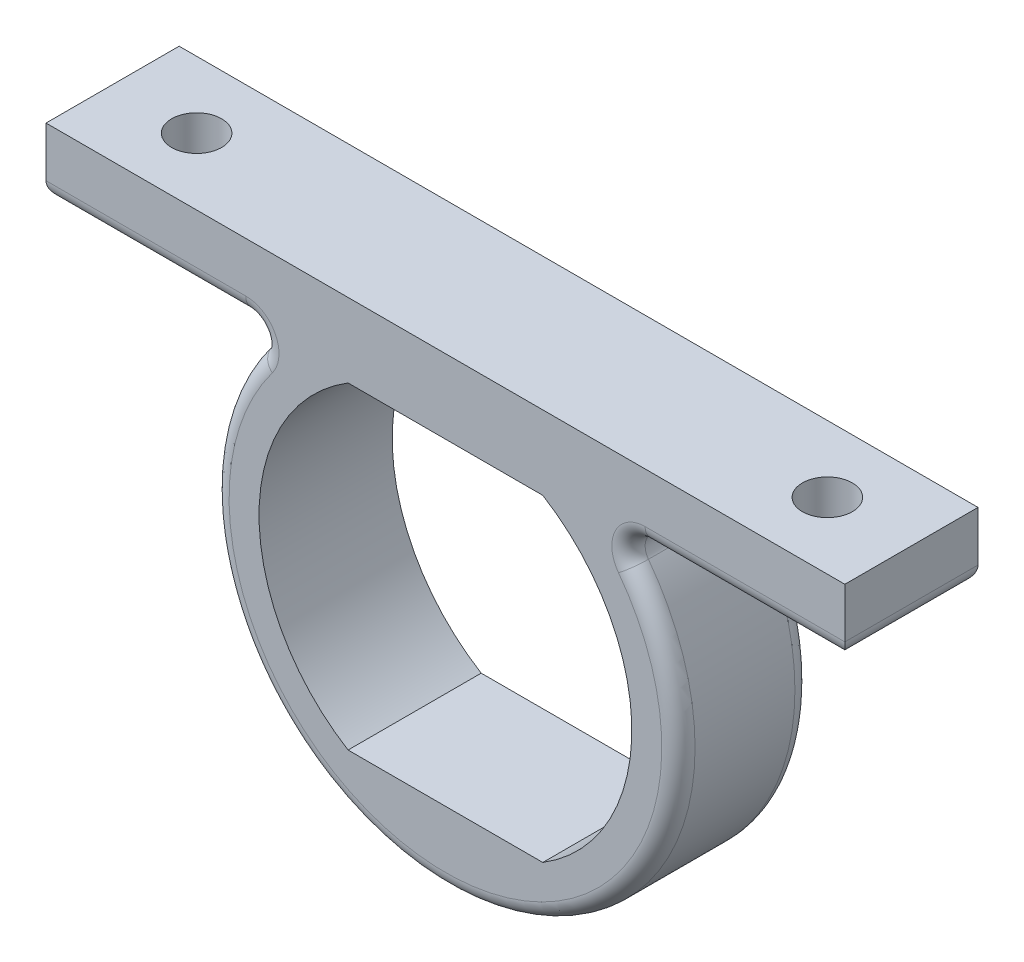
from build123d import *

# Parameters (mm, degrees)
SALIENTE_EXTRUIR1_DEPTH = 8
CORTAR_EXTRUIR1_DEPTH   = 29.91366459
REDONDEO1_R             = 1
CROQUIS3_R              = 1.5
CORTAR_EXTRUIR2_DEPTH   = 35.871191548


with BuildPart() as part:
    # Croquis1 → Saliente-Extruir1 (new body)
    with BuildSketch(Plane.XY):
        with BuildLine():
            Line((0, 14), (-24, 14))
            Line((-24, 14), (-24, 10))
            Line((-24, 10), (-9.797958971, 10))
            ThreePointArc((-9.797958971, 10), (0, -14), (9.797958971, 10))
            Line((9.797958971, 10), (24, 10))
            Line((24, 10), (24, 14))
            Line((24, 14), (0, 14))
        make_face()
    extrude(amount=SALIENTE_EXTRUIR1_DEPTH)

    # Croquis2 → Cortar-Extruir1 (cut, through all)
    with BuildSketch(Plane.XY.offset(8)):
        with BuildLine():
            Line((-5.85, 9.550785308), (5.85, 9.550785308))
            ThreePointArc((5.85, 9.550785308), (11.2, 0), (5.85, -9.550785308))
            Line((5.85, -9.550785308), (-5.85, -9.550785308))
            ThreePointArc((-5.85, -9.550785308), (-11.2, 0), (-5.85, 9.550785308))
        make_face()
    extrude(amount=-CORTAR_EXTRUIR1_DEPTH, mode=Mode.SUBTRACT)

    # Redondeo1
    redondeo1_edges = [part.edges().sort_by_distance(p)[0] for p in [
        (16.898979486, 10, 8),
        (-24, 10, 4),
        (-9.797958971, 10, 4),
        (9.797958971, 10, 4),
        (24, 10, 4),
        (0, -14, 8),
        (-16.898979486, 10, 8),
        (-16.898979486, 10, 0),
        (0, -14, 0),
        (16.898979486, 10, 0),
    ]]
    fillet(redondeo1_edges, radius=REDONDEO1_R)

    # Croquis3 → Cortar-Extruir2 (cut, through all)
    with BuildSketch(Plane(origin=(0, 10, 0), x_dir=(-1, 0, 0), z_dir=(0, -1, 0))):
        with Locations(Location((18.949489743, -4, 0), (0, 0, 90))):
            Circle(CROQUIS3_R)
        with Locations(Location((-18.949489743, -4, 0), (0, 0, 90))):
            Circle(CROQUIS3_R)
    extrude(amount=-CORTAR_EXTRUIR2_DEPTH, mode=Mode.SUBTRACT)


solid = part.part
